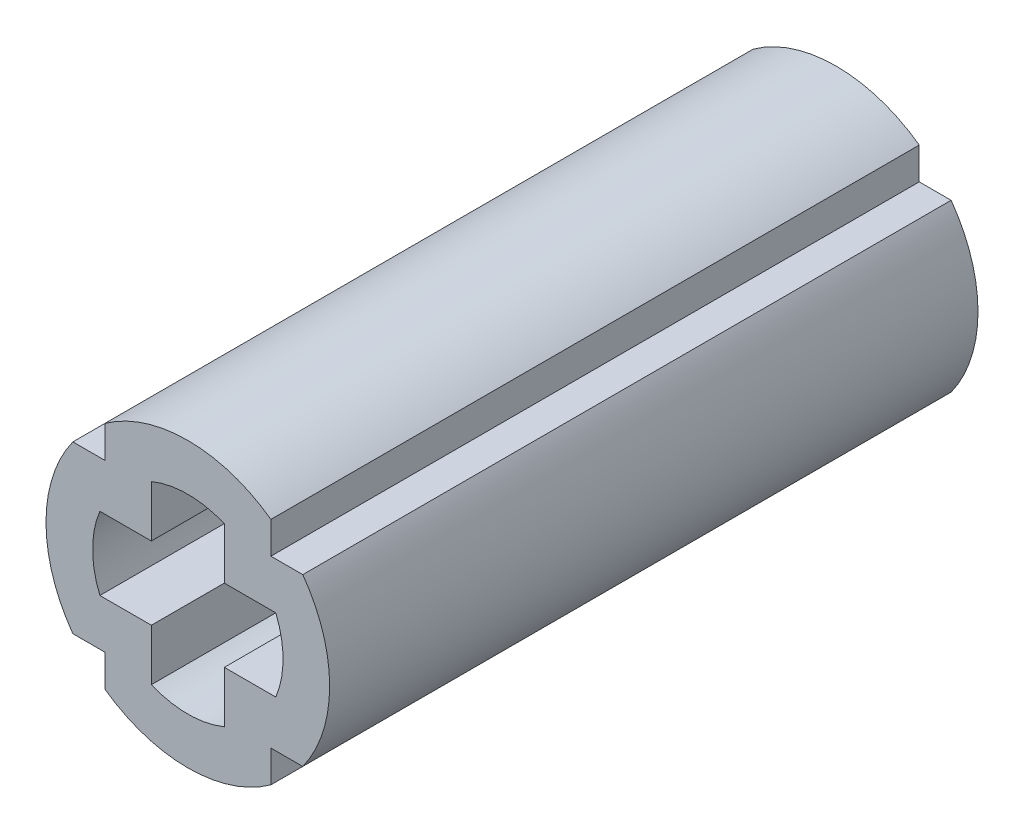
from build123d import *

# Parameters (mm, degrees)
BOSS_EXTRUDE1_DEPTH = 16


with BuildPart() as part:
    # Sketch1 → Boss-Extrude1 (new body)
    with BuildSketch(Plane.XY):
        with BuildLine():
            Line((-2.05, 2.836811591), (-2.05, 2.05))
            Line((-2.05, 2.05), (-2.836811591, 2.05))
            ThreePointArc((-2.836811591, 2.05), (-3.5, 0), (-2.836811591, -2.05))
            Line((-2.836811591, -2.05), (-2.05, -2.05))
            Line((-2.05, -2.05), (-2.05, -2.836811591))
            ThreePointArc((-2.05, -2.836811591), (0, -3.5), (2.05, -2.836811591))
            Line((2.05, -2.836811591), (2.05, -2.05))
            Line((2.05, -2.05), (2.836811591, -2.05))
            ThreePointArc((2.836811591, -2.05), (3.5, 0), (2.836811591, 2.05))
            Line((2.836811591, 2.05), (2.05, 2.05))
            Line((2.05, 2.05), (2.05, 2.836811591))
            ThreePointArc((2.05, 2.836811591), (0, 3.5), (-2.05, 2.836811591))
        make_face()
        with BuildLine():
            Line((-0.9, 2.170829335), (-0.9, 0.9))
            Line((-0.9, 0.9), (-2.170829335, 0.9))
            ThreePointArc((-2.170829335, 0.9), (-2.35, 0), (-2.170829335, -0.9))
            Line((-2.170829335, -0.9), (-0.9, -0.9))
            Line((-0.9, -0.9), (-0.9, -2.170829335))
            ThreePointArc((-0.9, -2.170829335), (0, -2.35), (0.9, -2.170829335))
            Line((0.9, -2.170829335), (0.9, -0.9))
            Line((0.9, -0.9), (2.170829335, -0.9))
            ThreePointArc((2.170829335, -0.9), (2.35, 0), (2.170829335, 0.9))
            Line((2.170829335, 0.9), (0.9, 0.9))
            Line((0.9, 0.9), (0.9, 2.170829335))
            ThreePointArc((0.9, 2.170829335), (0, 2.35), (-0.9, 2.170829335))
        make_face(mode=Mode.SUBTRACT)
    extrude(amount=BOSS_EXTRUDE1_DEPTH)


solid = part.part
